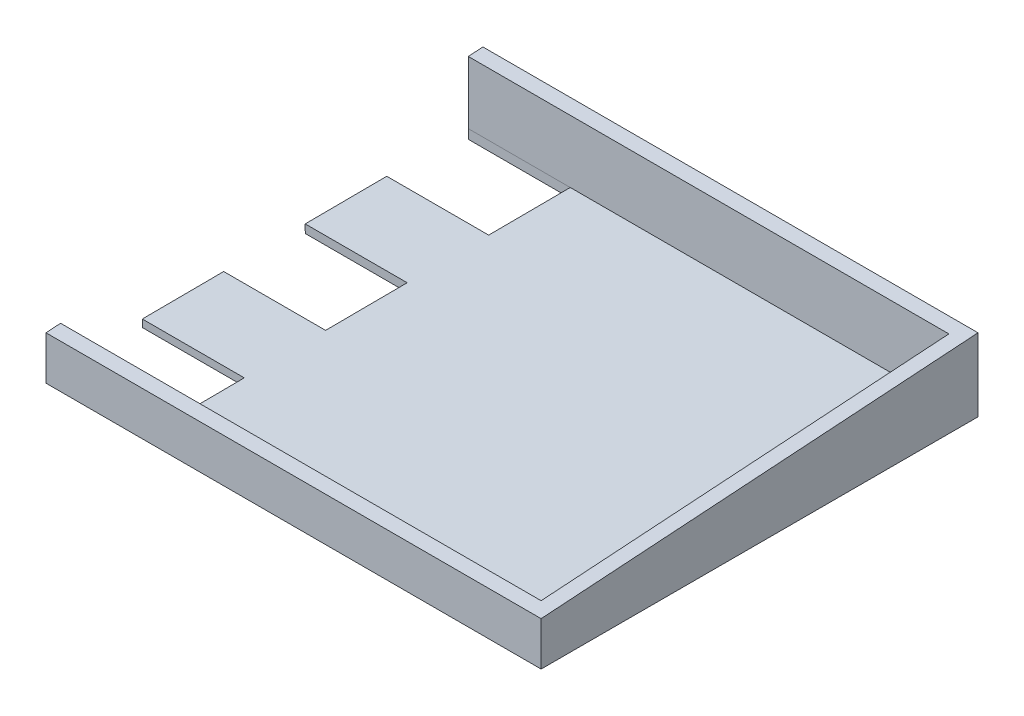
from build123d import *

# Parameters (mm, degrees)
BOSS_EXTRUDE1_DEPTH = 170
CUT_EXTRUDE1_DEPTH  = 165
SKETCH5_W           = 35
SKETCH5_H           = 28
CUT_EXTRUDE3_DEPTH  = 228.794623549
SKETCH6_W           = 35
SKETCH6_H           = 28
CUT_EXTRUDE5_DEPTH  = 228.794623549
SKETCH8_W           = 35
SKETCH8_H           = 28
CUT_EXTRUDE9_DEPTH  = 228.794623549


with BuildPart() as part:
    # Sketch2 → Boss-Extrude1 (new body)
    with BuildSketch(Plane(origin=(0, 0, 0), x_dir=(0, 0, -1), z_dir=(1, 0, 0))):
        Polygon((150, 10), (150, -15), (0, -15), (0, 0), align=None)
    extrude(amount=-BOSS_EXTRUDE1_DEPTH)

    # Sketch3 → Cut-Extrude1 (cut)
    with BuildSketch(Plane.ZY.offset(170)):
        Polygon((-145, 9.666666667), (-145, -11.8), (-5, -12.6), (-5, 0.333333333), align=None)
    extrude(amount=-CUT_EXTRUDE1_DEPTH, mode=Mode.SUBTRACT)

    # Sketch5 → Cut-Extrude3 (cut, through all)
    with BuildSketch(Plane(origin=(0, -12.628159081, -0.072160909), x_dir=(1, 0, 0), z_dir=(0, 0.9999836738692104, 0.005714192422109776))):
        with Locations((-152.5, 130.93020524)):
            Rectangle(SKETCH5_W, SKETCH5_H)
    extrude(amount=-CUT_EXTRUDE3_DEPTH, mode=Mode.SUBTRACT)

    # Sketch6 → Cut-Extrude5 (cut, through all)
    with BuildSketch(Plane(origin=(0, -12.628159081, -0.072160909), x_dir=(1, 0, 0), z_dir=(0, 0.9999836738692104, 0.005714192422109776))):
        with Locations((-152.5, 74.93020524)):
            Rectangle(SKETCH6_W, SKETCH6_H)
    extrude(amount=-CUT_EXTRUDE5_DEPTH, mode=Mode.SUBTRACT)

    # Sketch8 → Cut-Extrude9 (cut, through all)
    with BuildSketch(Plane(origin=(0, -12.628159081, -0.072160909), x_dir=(1, 0, 0), z_dir=(0, 0.9999836738692104, 0.005714192422109776))):
        with Locations((-152.5, 19.0018231)):
            Rectangle(SKETCH8_W, SKETCH8_H)
    extrude(amount=-CUT_EXTRUDE9_DEPTH, mode=Mode.SUBTRACT)


solid = part.part
